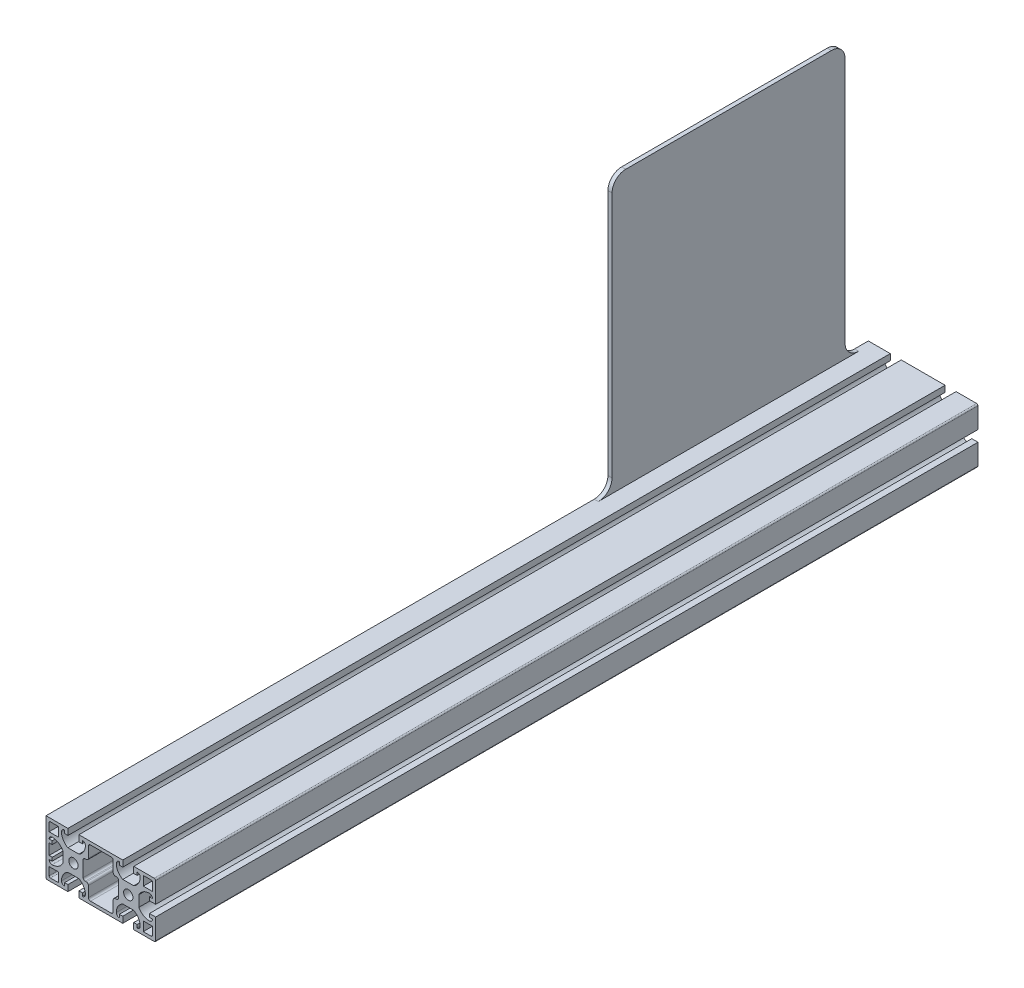
from build123d import *

# Parameters (mm, degrees)
SZKIC1_R                    = 3.4
DODANIE_WYCI_GNI_CIE1_DEPTH = 600
SZKIC2_W                    = 170
SZKIC2_H                    = 200
DODANIE_WYCI_GNI_CIE3_DEPTH = 3
ZAOKR_GLENIE1_R             = 10


with BuildPart() as part:
    # Szkic1 → Dodanie-wyciągnięcie1 (new body)
    with BuildSketch(Plane.XY):
        with BuildLine():
            Line((-40, -19), (-40, 20))
            Line((-40, 20), (-24, 20))
            Line((-24, 20), (-24, 15.5))
            Line((-24, 15.5), (-26.471381771, 15.5))
            Line((-26.471381771, 15.5), (-26.471381771, 17.75))
            ThreePointArc((-26.471381771, 17.75), (-28.062372029, 17.090990258), (-28.721381771, 15.5))
            ThreePointArc((-28.721381771, 15.5), (-27.448087912, 10.962546258), (-24, 7.75))
            Line((-24, 7.75), (-16, 7.75))
            ThreePointArc((-16, 7.75), (-12.551912088, 10.962546258), (-11.278618229, 15.5))
            ThreePointArc((-11.278618229, 15.5), (-11.937627971, 17.090990258), (-13.528618229, 17.75))
            Line((-13.528618229, 17.75), (-13.528618229, 15.5))
            Line((-13.528618229, 15.5), (-16, 15.5))
            Line((-16, 15.5), (-16, 20))
            Line((-16, 20), (13.528618229, 20))
            Line((13.528618229, 20), (16, 20))
            Line((16, 20), (16, 15.5))
            Line((16, 15.5), (13.528618229, 15.5))
            Line((13.528618229, 15.5), (13.528618229, 17.75))
            ThreePointArc((13.528618229, 17.75), (11.937627971, 17.090990258), (11.278618229, 15.5))
            ThreePointArc((11.278618229, 15.5), (12.551912088, 10.962546258), (16, 7.75))
            Line((16, 7.75), (24, 7.75))
            ThreePointArc((24, 7.75), (27.448087912, 10.962546258), (28.721381771, 15.5))
            ThreePointArc((28.721381771, 15.5), (28.062372029, 17.090990258), (26.471381771, 17.75))
            Line((26.471381771, 17.75), (26.471381771, 15.5))
            Line((26.471381771, 15.5), (24, 15.5))
            Line((24, 15.5), (24, 20))
            Line((24, 20), (39, 20))
            ThreePointArc((39, 20), (39.707106781, 19.707106781), (40, 19))
            Line((40, 19), (40, 4))
            Line((40, 4), (35.5, 4))
            Line((35.5, 4), (35.5, 6.471381771))
            Line((35.5, 6.471381771), (37.75, 6.471381771))
            ThreePointArc((37.75, 6.471381771), (37.090990258, 8.062372029), (35.5, 8.721381771))
            ThreePointArc((35.5, 8.721381771), (30.962546258, 7.448087912), (27.75, 4))
            Line((27.75, 4), (27.75, -4))
            ThreePointArc((27.75, -4), (30.962546258, -7.448087912), (35.5, -8.721381771))
            ThreePointArc((35.5, -8.721381771), (37.090990258, -8.062372029), (37.75, -6.471381771))
            Line((37.75, -6.471381771), (35.5, -6.471381771))
            Line((35.5, -6.471381771), (35.5, -4))
            Line((35.5, -4), (40, -4))
            Line((40, -4), (40, -19))
            ThreePointArc((40, -19), (39.707106781, -19.707106781), (39, -20))
            Line((39, -20), (24, -20))
            Line((24, -20), (24, -15.5))
            Line((24, -15.5), (26.471381771, -15.5))
            Line((26.471381771, -15.5), (26.471381771, -17.75))
            ThreePointArc((26.471381771, -17.75), (28.062372029, -17.090990258), (28.721381771, -15.5))
            ThreePointArc((28.721381771, -15.5), (27.448087912, -10.962546258), (24, -7.75))
            Line((24, -7.75), (16, -7.75))
            ThreePointArc((16, -7.75), (12.551912088, -10.962546258), (11.278618229, -15.5))
            ThreePointArc((11.278618229, -15.5), (11.937627971, -17.090990258), (13.528618229, -17.75))
            Line((13.528618229, -17.75), (13.528618229, -15.5))
            Line((13.528618229, -15.5), (16, -15.5))
            Line((16, -15.5), (16, -20))
            Line((16, -20), (-16, -20))
            Line((-16, -20), (-16, -15.5))
            Line((-16, -15.5), (-13.528618229, -15.5))
            Line((-13.528618229, -15.5), (-13.528618229, -17.75))
            ThreePointArc((-13.528618229, -17.75), (-11.937627971, -17.090990258), (-11.278618229, -15.5))
            ThreePointArc((-11.278618229, -15.5), (-12.551912088, -10.962546258), (-16, -7.75))
            Line((-16, -7.75), (-24, -7.75))
            ThreePointArc((-24, -7.75), (-27.448087912, -10.962546258), (-28.721381771, -15.5))
            ThreePointArc((-28.721381771, -15.5), (-28.062372029, -17.090990258), (-26.471381771, -17.75))
            Line((-26.471381771, -17.75), (-26.471381771, -15.5))
            Line((-26.471381771, -15.5), (-24, -15.5))
            Line((-24, -15.5), (-24, -20))
            Line((-24, -20), (-39, -20))
            ThreePointArc((-39, -20), (-39.707106781, -19.707106781), (-40, -19))
        make_face()
        with Locations((-20, 0)):
            Circle(SZKIC1_R, mode=Mode.SUBTRACT)
        with Locations((20, 0)):
            Circle(SZKIC1_R, mode=Mode.SUBTRACT)
        with BuildLine():
            Line((30.971381771, -17.75), (36.75, -17.75))
            ThreePointArc((36.75, -17.75), (37.457106781, -17.457106781), (37.75, -16.75))
            Line((37.75, -16.75), (37.75, -10.971381771))
            Line((37.75, -10.971381771), (30.971381771, -10.971381771))
            Line((30.971381771, -10.971381771), (30.971381771, -17.75))
        make_face(mode=Mode.SUBTRACT)
        with BuildLine():
            Line((-35.5, -6.471381771), (-37.75, -6.471381771))
            ThreePointArc((-37.75, -6.471381771), (-37.090990258, -8.062372029), (-35.5, -8.721381771))
            ThreePointArc((-35.5, -8.721381771), (-30.962546258, -7.448087912), (-27.75, -4))
            Line((-27.75, -4), (-27.75, 4))
            ThreePointArc((-27.75, 4), (-30.962546258, 7.448087912), (-35.5, 8.721381771))
            ThreePointArc((-35.5, 8.721381771), (-37.090990258, 8.062372029), (-37.75, 6.471381771))
            Line((-37.75, 6.471381771), (-35.5, 6.471381771))
            Line((-35.5, 6.471381771), (-35.5, 4))
            Line((-35.5, 4), (-37.75, 4))
            Line((-37.75, 4), (-37.75, -4))
            Line((-37.75, -4), (-35.5, -4))
            Line((-35.5, -4), (-35.5, -6.471381771))
        make_face(mode=Mode.SUBTRACT)
        with BuildLine():
            Line((10.528618229, 7.090188806), (11.40950808, 7.090188806))
            ThreePointArc((11.40950808, 7.090188806), (12.470168251, 6.650848977), (12.90950808, 5.590188806))
            Line((12.90950808, 5.590188806), (12.90950808, -5.590188806))
            ThreePointArc((12.90950808, -5.590188806), (12.470168251, -6.650848977), (11.40950808, -7.090188806))
            Line((11.40950808, -7.090188806), (10.528618229, -7.090188806))
            ThreePointArc((10.528618229, -7.090188806), (9.467958057, -7.529528634), (9.028618229, -8.590188806))
            Line((9.028618229, -8.590188806), (9.028618229, -16.25))
            ThreePointArc((9.028618229, -16.25), (8.589278401, -17.310660172), (7.528618229, -17.75))
            Line((7.528618229, -17.75), (-7.528618229, -17.75))
            ThreePointArc((-7.528618229, -17.75), (-8.589278401, -17.310660172), (-9.028618229, -16.25))
            Line((-9.028618229, -16.25), (-9.028618229, -8.590188806))
            ThreePointArc((-9.028618229, -8.590188806), (-9.467958057, -7.529528634), (-10.528618229, -7.090188806))
            Line((-10.528618229, -7.090188806), (-11.40950808, -7.090188806))
            ThreePointArc((-11.40950808, -7.090188806), (-12.470168251, -6.650848977), (-12.90950808, -5.590188806))
            Line((-12.90950808, -5.590188806), (-12.90950808, 5.590188806))
            ThreePointArc((-12.90950808, 5.590188806), (-12.470168251, 6.650848977), (-11.40950808, 7.090188806))
            Line((-11.40950808, 7.090188806), (-10.528618229, 7.090188806))
            ThreePointArc((-10.528618229, 7.090188806), (-9.467958057, 7.529528634), (-9.028618229, 8.590188806))
            Line((-9.028618229, 8.590188806), (-9.028618229, 16.25))
            ThreePointArc((-9.028618229, 16.25), (-8.589278401, 17.310660172), (-7.528618229, 17.75))
            Line((-7.528618229, 17.75), (7.528618229, 17.75))
            ThreePointArc((7.528618229, 17.75), (8.589278401, 17.310660172), (9.028618229, 16.25))
            Line((9.028618229, 16.25), (9.028618229, 8.590188806))
            ThreePointArc((9.028618229, 8.590188806), (9.467958057, 7.529528634), (10.528618229, 7.090188806))
        make_face(mode=Mode.SUBTRACT)
        with BuildLine():
            Line((30.971381771, 10.971381771), (37.75, 10.971381771))
            Line((37.75, 10.971381771), (37.75, 16.75))
            ThreePointArc((37.75, 16.75), (37.457106781, 17.457106781), (36.75, 17.75))
            Line((36.75, 17.75), (30.971381771, 17.75))
            Line((30.971381771, 17.75), (30.971381771, 10.971381771))
        make_face(mode=Mode.SUBTRACT)
        with BuildLine():
            Line((-30.971381771, -10.971381771), (-30.971381771, -17.75))
            Line((-30.971381771, -17.75), (-36.75, -17.75))
            ThreePointArc((-36.75, -17.75), (-37.457106781, -17.457106781), (-37.75, -16.75))
            Line((-37.75, -16.75), (-37.75, -10.971381771))
            Line((-37.75, -10.971381771), (-30.971381771, -10.971381771))
        make_face(mode=Mode.SUBTRACT)
        with BuildLine():
            Line((-30.971381771, 17.75), (-36.75, 17.75))
            ThreePointArc((-36.75, 17.75), (-37.457106781, 17.457106781), (-37.75, 16.75))
            Line((-37.75, 16.75), (-37.75, 10.971381771))
            Line((-37.75, 10.971381771), (-30.971381771, 10.971381771))
            Line((-30.971381771, 10.971381771), (-30.971381771, 17.75))
        make_face(mode=Mode.SUBTRACT)
    extrude(amount=DODANIE_WYCI_GNI_CIE1_DEPTH)

    # Szkic2 → Dodanie-wyciągnięcie3 (add)
    with BuildSketch(Plane.ZY.offset(40)):
        with Locations((105, 120)):
            Rectangle(SZKIC2_W, SZKIC2_H)
    extrude(amount=-DODANIE_WYCI_GNI_CIE3_DEPTH)

    # Zaokrąglenie1
    zaokr_glenie1_edges = [part.edges().sort_by_distance(p)[0] for p in [
        (-38.5, 20, 20),
        (-38.5, 220, 20),
        (-38.5, 220, 190),
        (-38.5, 20, 190),
    ]]
    fillet(zaokr_glenie1_edges, radius=ZAOKR_GLENIE1_R)


solid = part.part
